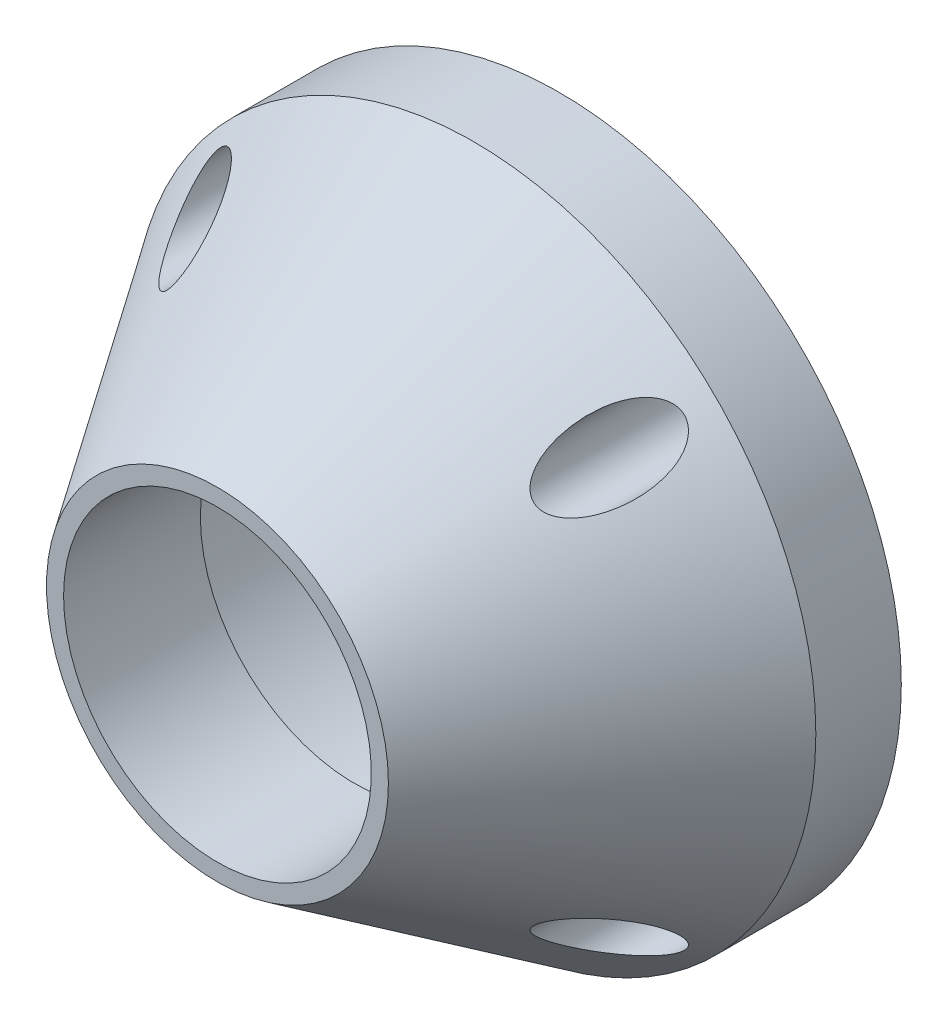
from build123d import *

# Parameters (mm, degrees)
SKETCH8_R          = 4
CUT_EXTRUDE1_DEPTH = 121
SKETCH8_9_R        = 10
CUT_EXTRUDE2_DEPTH = 90


with BuildPart() as part:
    # Sketch6 → Revolve1 (revolve)
    with BuildSketch(Plane.YZ):
        Polygon((0, 0), (-100, 0), (-100, 25), (-50, 100), (0, 100), align=None)
    revolve(axis=Axis((0, 0, 100), (0, 0, -1)))

    # Sketch7 → Cut-Revolve1 (revolve, cut)
    with BuildSketch(Plane(origin=(0, 0, 0), x_dir=(-1, 0, 0), z_dir=(0, 1, 0))):
        Polygon((0, 25), (-45, 25), (-60, 25), (-60, 60), (-45, 60), (-45, 100), (0, 100), align=None)
    revolve(axis=Axis((0, 0, 25), (0, 0, 1)), mode=Mode.SUBTRACT)

    # Sketch8 → Cut-Extrude1 (cut)
    with BuildSketch(Plane.XY.offset(100)):
        with Locations((-60.710678119, 60.710678119)):
            Circle(SKETCH8_R)
        with Locations((60.710678119, 60.710678119)):
            Circle(SKETCH8_R)
        with Locations((60.710678119, -60.710678119)):
            Circle(SKETCH8_R)
        with Locations((-60.710678119, -60.710678119)):
            Circle(SKETCH8_R)
    extrude(amount=-CUT_EXTRUDE1_DEPTH, mode=Mode.SUBTRACT)

    # Sketch8<9> → Cut-Extrude2 (cut)
    with BuildSketch(Plane.XY.offset(100)):
        with Locations((-60.710678119, 60.710678119)):
            Circle(SKETCH8_9_R)
        with Locations((60.710678119, 60.710678119)):
            Circle(SKETCH8_9_R)
        with Locations((60.710678119, -60.710678119)):
            Circle(SKETCH8_9_R)
        with Locations((-60.710678119, -60.710678119)):
            Circle(SKETCH8_9_R)
    extrude(amount=-CUT_EXTRUDE2_DEPTH, mode=Mode.SUBTRACT)


solid = part.part
